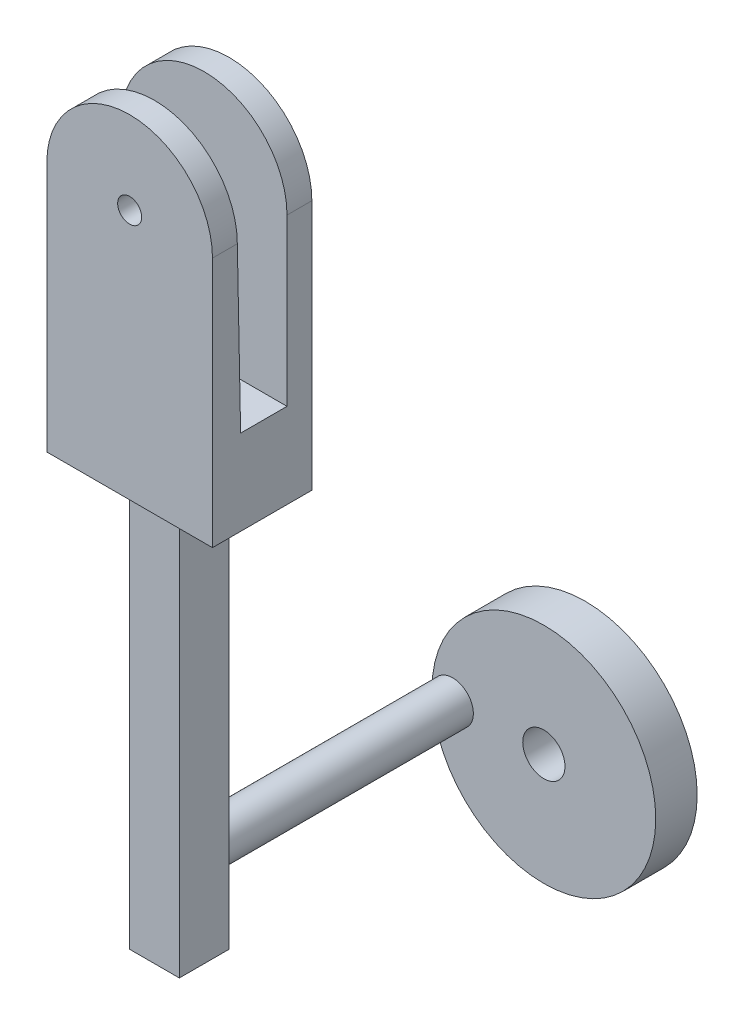
from build123d import *

# Parameters (mm, degrees)
SKETCH_1_R          = 1.45
EXTRUDE_1_DEPTH     = 12
CUT_EXTRUDE_1_DEPTH = 39.218600963
SKETCH_3_W          = 6
SKETCH_3_H          = 6
EXTRUDE_5_DEPTH     = 50
EXTRUDE_6_DEPTH     = 30
SKETCH_9_R          = 13.511017451
EXTRUDE_10_DEPTH    = 5
SKETCH_10_R         = 2.55
CUT_EXTRUDE_5_DEPTH = 99.282815089


with BuildPart() as part:
    # 草圖1 → 填料-伸長1 (new body)
    with BuildSketch(Plane.XY):
        with BuildLine():
            Line((-10, 0), (-10, -30.276417548))
            Line((-10, -30.276417548), (10, -30.276417548))
            Line((10, -30.276417548), (10, 0))
            ThreePointArc((10, 0), (0, 10), (-10, 0))
        make_face()
        Circle(SKETCH_1_R, mode=Mode.SUBTRACT)
    extrude(amount=EXTRUDE_1_DEPTH)

    # 草圖2 → 除料-伸長1 (cut, through all)
    with BuildSketch(Plane(origin=(10, 0, 0), x_dir=(0, 0, -1), z_dir=(1, 0, 0))):
        Polygon((-9, 0), (-6, 0), (-3, 0), (-3, 15.780779257), (-9, 15.780779257), align=None)
        Polygon((-3, 0), (-6, 0), (-9, 0), (-8.60053373, -20), (-3, -20), align=None)
    extrude(amount=-CUT_EXTRUDE_1_DEPTH, mode=Mode.SUBTRACT)

    # 草圖3 → 填料-伸長5 (add)
    with BuildSketch(Plane.XZ.offset(30.276417548)):
        with Locations((0, 6)):
            Rectangle(SKETCH_3_W, SKETCH_3_H)
    extrude(amount=EXTRUDE_5_DEPTH)

    # 草圖8 → 填料-伸長6 (add)
    with BuildSketch(Plane(origin=(0, 0, 3), x_dir=(-1, 0, 0), z_dir=(0, 0, -1))):
        with BuildLine():
            ThreePointArc((2.5, -70.882000899), (0, -68.382000899), (-2.5, -70.882000899))
            Line((-2.5, -70.882000899), (2.5, -70.882000899))
        make_face()
        with BuildLine():
            Line((2.5, -70.882000899), (-2.5, -70.882000899))
            ThreePointArc((-2.5, -70.882000899), (0, -73.382000899), (2.5, -70.882000899))
        make_face()
    extrude(amount=EXTRUDE_6_DEPTH)

    # 草圖9 → 填料-伸長10 (add)
    with BuildSketch(Plane(origin=(0, 0, -27), x_dir=(-1, 0, 0), z_dir=(0, 0, -1))):
        with Locations((-11.011017451, -70.882000899)):
            Circle(SKETCH_9_R)
    extrude(amount=EXTRUDE_10_DEPTH)

    # 草圖10 → 除料-伸長5 (cut, through all)
    with BuildSketch(Plane(origin=(0, 0, -32), x_dir=(-1, 0, 0), z_dir=(0, 0, -1))):
        with Locations((-11.011017451, -70.882000899)):
            Circle(SKETCH_10_R)
    extrude(amount=-CUT_EXTRUDE_5_DEPTH, mode=Mode.SUBTRACT)


solid = part.part
